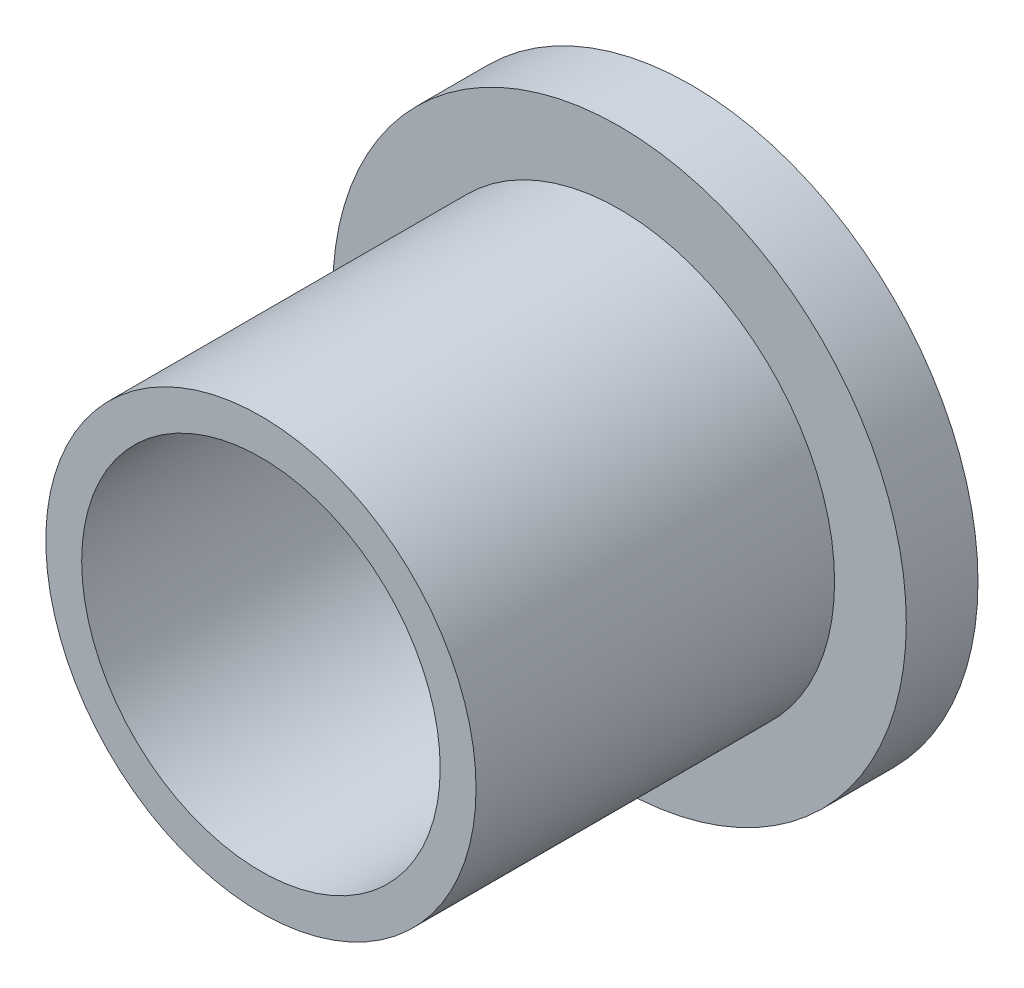
from build123d import *

# Parameters (mm, degrees)
CROQUIS1_R              = 40
SALIENTE_EXTRUIR1_DEPTH = 10
CROQUIS2_R              = 30
CROQUIS2_R_2            = 25
SALIENTE_EXTRUIR2_DEPTH = 50


with BuildPart() as part:
    # Croquis1 → Saliente-Extruir1 (new body)
    with BuildSketch(Plane.XY):
        Circle(CROQUIS1_R)
    extrude(amount=SALIENTE_EXTRUIR1_DEPTH)

    # Croquis2 → Saliente-Extruir2 (add)
    with BuildSketch(Plane.XY.offset(10)):
        Circle(CROQUIS2_R)
        Circle(CROQUIS2_R_2, mode=Mode.SUBTRACT)
    extrude(amount=SALIENTE_EXTRUIR2_DEPTH)


solid = part.part
